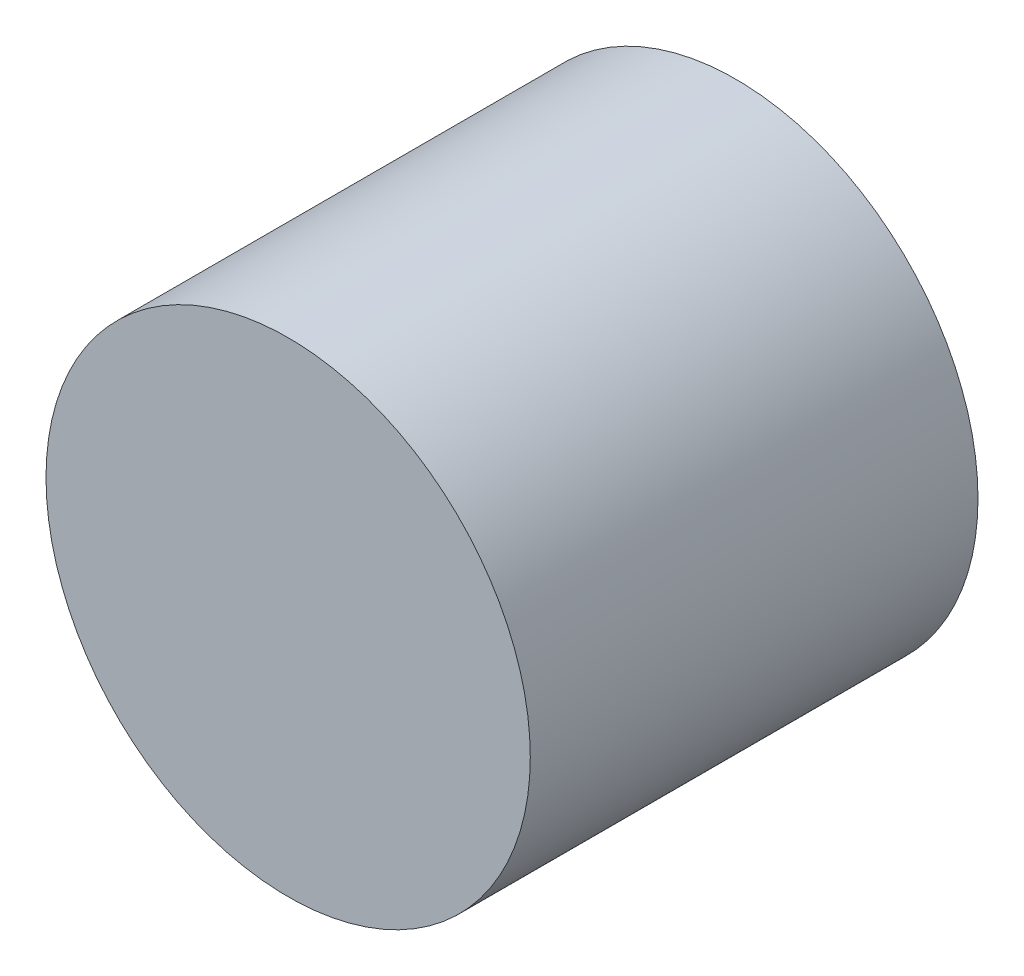
from build123d import *

# Parameters (mm, degrees)
SKETCH1_R           = 48.137692039
SKETCH1_R_2         = 45.149668872
BOSS_EXTRUDE1_DEPTH = 83
SKETCH2_R           = 48.137692039
BOSS_EXTRUDE2_DEPTH = 3
BOSS_EXTRUDE3_START = 3
SKETCH3_R           = 48.137692039
BOSS_EXTRUDE3_DEPTH = 3
SKETCH4_R           = 20.853102152
CUT_EXTRUDE1_DEPTH  = 17


with BuildPart() as part:
    # Sketch1 → Boss-Extrude1 (new body)
    with BuildSketch(Plane.XY):
        Circle(SKETCH1_R)
        Circle(SKETCH1_R_2, mode=Mode.SUBTRACT)
    extrude(amount=BOSS_EXTRUDE1_DEPTH)

    # Sketch2 → Boss-Extrude2 (add)
    with BuildSketch(Plane.XY.offset(83)):
        Circle(SKETCH2_R)
    extrude(amount=BOSS_EXTRUDE2_DEPTH)

    # Sketch3 → Boss-Extrude3 (add)
    with BuildSketch(Plane(origin=(0, 0, 0), x_dir=(-1, 0, 0), z_dir=(0, 0, -1)).offset(BOSS_EXTRUDE3_START)):
        Circle(SKETCH3_R)
    extrude(amount=-BOSS_EXTRUDE3_DEPTH)

    # Sketch4 → Cut-Extrude1 (cut)
    with BuildSketch(Plane(origin=(0, 0, -3), x_dir=(-1, 0, 0), z_dir=(0, 0, -1))):
        Circle(SKETCH4_R)
    extrude(amount=-CUT_EXTRUDE1_DEPTH, mode=Mode.SUBTRACT)


solid = part.part
